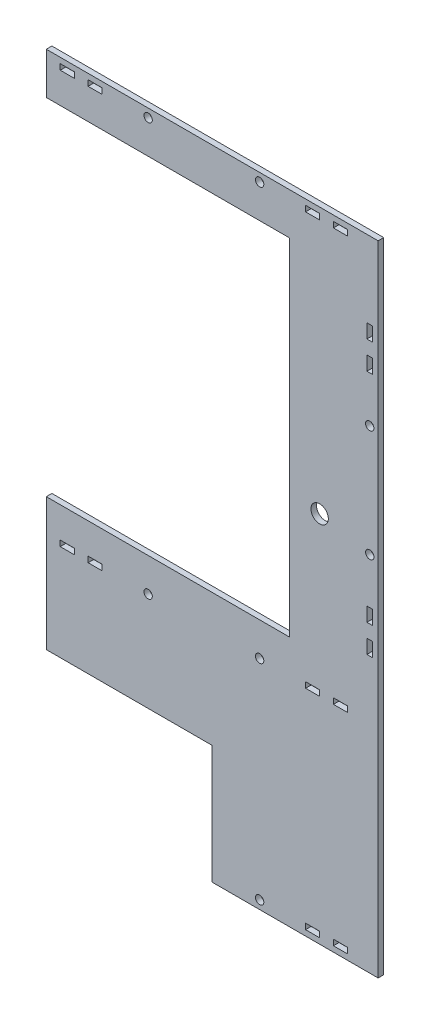
from build123d import *

# Parameters (mm, degrees)
SKETCH_1_R          = 1.5
SKETCH_1_R_2        = 3.121318996
SKETCH_1_W          = 5.05
SKETCH_1_H          = 2.05
SKETCH_1_W_2        = 2.05
SKETCH_1_H_2        = 5.05
EXTRUDE_1_DEPTH     = 2
SKETCH_2_W          = 59.515578234
SKETCH_2_H          = 42.494416296
CUT_EXTRUDE_1_DEPTH = 10


with BuildPart() as part:
    # 草图1 → 凸台-拉伸1 (new body)
    with BuildSketch(Plane.XY):
        Polygon((-56.111334712, -13.372248853), (31.071025228, -13.372248853), (31.071025228, -137.372248853), (-56.111334712, -137.372248853), (-56.111334712, -152.372248853), (-56.111334712, -227.397248853), (62.919821756, -227.397248853), (62.919821756, -152.372248853), (62.919821756, 1.627751147), (-56.111334712, 1.627751147), align=None)
        with Locations((-19.586334712, -1.372248853)):
            Circle(SKETCH_1_R, mode=Mode.SUBTRACT)
        with Locations((20.413665288, -1.372248853)):
            Circle(SKETCH_1_R, mode=Mode.SUBTRACT)
        with Locations((-19.586334712, -149.372248853)):
            Circle(SKETCH_1_R, mode=Mode.SUBTRACT)
        with Locations((20.413665288, -149.372248853)):
            Circle(SKETCH_1_R, mode=Mode.SUBTRACT)
        with Locations((59.919821756, -97.372248853)):
            Circle(SKETCH_1_R, mode=Mode.SUBTRACT)
        with Locations((59.919821756, -57.372248853)):
            Circle(SKETCH_1_R, mode=Mode.SUBTRACT)
        with Locations((41.938665288, -93.678088908)):
            Circle(SKETCH_1_R_2, mode=Mode.SUBTRACT)
        with Locations((-19.586334712, -224.372248853)):
            Circle(SKETCH_1_R, mode=Mode.SUBTRACT)
        with Locations((20.413665288, -224.372248853)):
            Circle(SKETCH_1_R, mode=Mode.SUBTRACT)
        with Locations((39.413665288, -1.372248853)):
            Rectangle(SKETCH_1_W, SKETCH_1_H, mode=Mode.SUBTRACT)
        with Locations((49.413665288, -1.372248853)):
            Rectangle(SKETCH_1_W, SKETCH_1_H, mode=Mode.SUBTRACT)
        with Locations((-48.586334712, -1.372248853)):
            Rectangle(SKETCH_1_W, SKETCH_1_H, mode=Mode.SUBTRACT)
        with Locations((-38.586334712, -1.372248853)):
            Rectangle(SKETCH_1_W, SKETCH_1_H, mode=Mode.SUBTRACT)
        with Locations((39.413665288, -149.372248853)):
            Rectangle(SKETCH_1_W, SKETCH_1_H, mode=Mode.SUBTRACT)
        with Locations((49.413665288, -149.372248853)):
            Rectangle(SKETCH_1_W, SKETCH_1_H, mode=Mode.SUBTRACT)
        with Locations((-48.586334712, -149.372248853)):
            Rectangle(SKETCH_1_W, SKETCH_1_H, mode=Mode.SUBTRACT)
        with Locations((-38.586334712, -149.372248853)):
            Rectangle(SKETCH_1_W, SKETCH_1_H, mode=Mode.SUBTRACT)
        with Locations((59.919821756, -38.372248853)):
            Rectangle(SKETCH_1_W_2, SKETCH_1_H_2, mode=Mode.SUBTRACT)
        with Locations((59.919821756, -28.372248853)):
            Rectangle(SKETCH_1_W_2, SKETCH_1_H_2, mode=Mode.SUBTRACT)
        with Locations((59.919821756, -126.372248853)):
            Rectangle(SKETCH_1_W_2, SKETCH_1_H_2, mode=Mode.SUBTRACT)
        with Locations((59.919821756, -116.372248853)):
            Rectangle(SKETCH_1_W_2, SKETCH_1_H_2, mode=Mode.SUBTRACT)
        with Locations((39.413665288, -224.372248853)):
            Rectangle(SKETCH_1_W, SKETCH_1_H, mode=Mode.SUBTRACT)
        with Locations((49.413665288, -224.372248853)):
            Rectangle(SKETCH_1_W, SKETCH_1_H, mode=Mode.SUBTRACT)
        with Locations((-48.586334712, -224.372248853)):
            Rectangle(SKETCH_1_W, SKETCH_1_H, mode=Mode.SUBTRACT)
        with Locations((-38.586334712, -224.372248853)):
            Rectangle(SKETCH_1_W, SKETCH_1_H, mode=Mode.SUBTRACT)
    extrude(amount=EXTRUDE_1_DEPTH)

    # 草图2 → 切除-拉伸1 (cut)
    with BuildSketch(Plane.XY.offset(2)):
        with Locations((-26.353545595, -206.150040705)):
            Rectangle(SKETCH_2_W, SKETCH_2_H)
    extrude(amount=-CUT_EXTRUDE_1_DEPTH, mode=Mode.SUBTRACT)


solid = part.part
